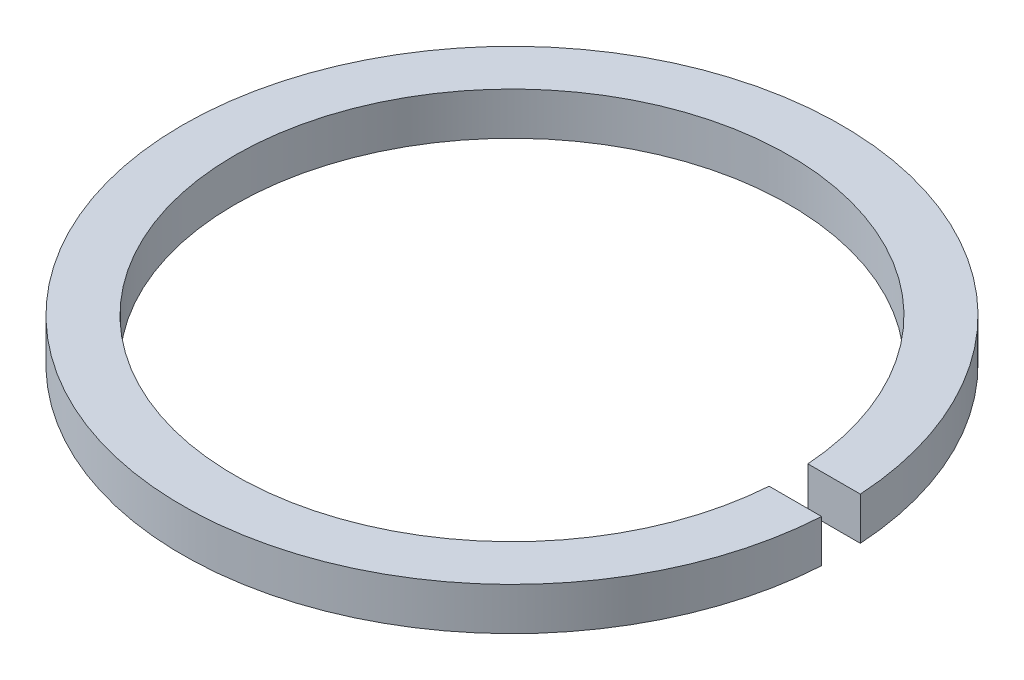
from build123d import *

# Parameters (mm, degrees)
SKETCH1_R           = 0.5
BOSS_EXTRUDE1_DEPTH = 1.1
SKETCH2_OUTSIDE_W   = 28.094
SKETCH2_OUTSIDE_H   = 26.594
SKETCH2_OUTSIDE_R   = 8.5
CUT_EXTRUDE1_DEPTH  = 10


with BuildPart() as part:
    # Sketch1 → Boss-Extrude1 (new body)
    with BuildSketch(Plane(origin=(0, 0, 0), x_dir=(1, 0, 0), z_dir=(0, 1, 0))):
        with BuildLine():
            Line((7.132496057, 0.5), (10.5, 0.5))
            ThreePointArc((10.5, 0.5), (10.853553391, 0.646446609), (11, 1))
            Line((11, 1), (11, 1.5))
            ThreePointArc((11, 1.5), (10.707106781, 2.207106781), (10, 2.5))
            Line((10, 2.5), (9.899494937, 2.5))
            ThreePointArc((9.899494937, 2.5), (9.322144667, 2.683503419), (8.956685895, 3.166666667))
            ThreePointArc((8.956685895, 3.166666667), (-9.5, 0), (8.956685895, -3.166666667))
            ThreePointArc((8.956685895, -3.166666667), (9.322144667, -2.683503419), (9.899494937, -2.5))
            Line((9.899494937, -2.5), (10, -2.5))
            ThreePointArc((10, -2.5), (10.707106781, -2.207106781), (11, -1.5))
            Line((11, -1.5), (11, -1))
            ThreePointArc((11, -1), (10.853553391, -0.646446609), (10.5, -0.5))
            Line((10.5, -0.5), (7.132496057, -0.5))
            ThreePointArc((7.132496057, -0.5), (-7.15, 0), (7.132496057, 0.5))
        make_face()
        with Locations(Location((10, 1.5, 0), (0, 0, 270))):
            Circle(SKETCH1_R, mode=Mode.SUBTRACT)
        with Locations(Location((10, -1.5, 0), (0, 0, 270))):
            Circle(SKETCH1_R, mode=Mode.SUBTRACT)
    extrude(amount=BOSS_EXTRUDE1_DEPTH)

    # Sketch2 outside → Cut-Extrude1 (cut)
    with BuildSketch(Plane(origin=(0, 1.1, 0), x_dir=(1, 0, 0), z_dir=(0, 1, 0))):
        with Locations((0.75, 0)):
            Rectangle(SKETCH2_OUTSIDE_W, SKETCH2_OUTSIDE_H)
        Circle(SKETCH2_OUTSIDE_R, mode=Mode.SUBTRACT)
    extrude(amount=-CUT_EXTRUDE1_DEPTH, mode=Mode.SUBTRACT)


solid = part.part
